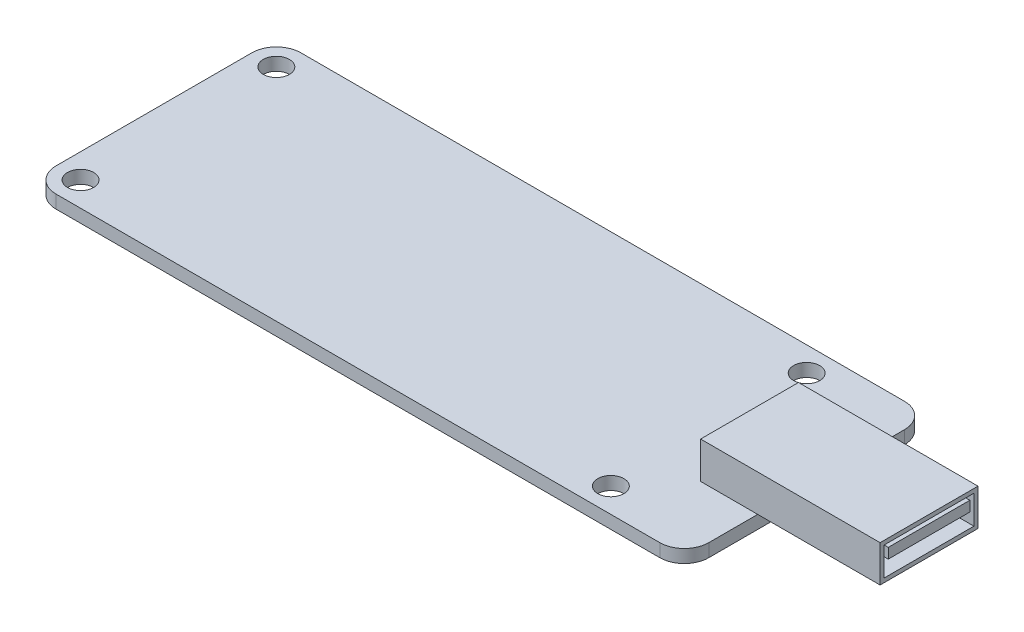
from build123d import *

# Parameters (mm, degrees)
PCB_OUTLINE_W                  = 80
PCB_OUTLINE_H                  = 30
PCB_BASE_DEPTH                 = 1.6
SKETCH3_W                      = 22
SKETCH3_H                      = 12
USB_CONNECTTOR_DUMMY_DEPTH     = 4.5
HOLE_LOCATIONS_R               = 1.6
MOUNTING_HOLES_DEPTH           = 58.18609971
SKETCH4_W                      = 11
SKETCH4_H                      = 3.5
SKETCH4_W_2                    = 10
SKETCH4_H_2                    = 1.25
USB_CONNECTOR_DUMMY_HOLE_DEPTH = 12
FILLET1_R                      = 3
SKETCH5_W                      = 1.5
SKETCH5_H                      = 1.5
CUT_EXTRUDE1_DEPTH             = 0.5


with BuildPart() as part:
    # PCB_Outline → PCB_Base (new body)
    with BuildSketch(Plane(origin=(0, 0, 0), x_dir=(1, 0, 0), z_dir=(0, 1, 0))):
        Rectangle(PCB_OUTLINE_W, PCB_OUTLINE_H)
    extrude(amount=PCB_BASE_DEPTH)

    # Sketch3 → USB_Connecttor_Dummy (add)
    with BuildSketch(Plane(origin=(0, 1.6, 0), x_dir=(1, 0, 0), z_dir=(0, 1, 0))):
        with Locations((44, 0)):
            Rectangle(SKETCH3_W, SKETCH3_H)
    extrude(amount=USB_CONNECTTOR_DUMMY_DEPTH)

    # Hole_Locations → Mounting_Holes (cut, through all)
    with BuildSketch(Plane(origin=(0, 1.6, 0), x_dir=(1, 0, 0), z_dir=(0, 1, 0))):
        with Locations(Location((-37, 12, 0), (0, 0, 270))):
            Circle(HOLE_LOCATIONS_R)
        with Locations(Location((28, 12, 0), (0, 0, 270))):
            Circle(HOLE_LOCATIONS_R)
        with Locations(Location((-37, -12, 0), (0, 0, 90))):
            Circle(HOLE_LOCATIONS_R)
        with Locations(Location((28, -12, 0), (0, 0, 90))):
            Circle(HOLE_LOCATIONS_R)
    extrude(amount=-MOUNTING_HOLES_DEPTH, mode=Mode.SUBTRACT)

    # Sketch4 → USB_Connector_Dummy_Hole (cut)
    with BuildSketch(Plane(origin=(55, 0, 0), x_dir=(0, 0, -1), z_dir=(1, 0, 0))):
        with Locations((0, 3.85)):
            Rectangle(SKETCH4_W, SKETCH4_H)
        with Locations((0, 4.475)):
            Rectangle(SKETCH4_W_2, SKETCH4_H_2, mode=Mode.SUBTRACT)
    extrude(amount=-USB_CONNECTOR_DUMMY_HOLE_DEPTH, mode=Mode.SUBTRACT)

    # Fillet1
    fillet1_edges = [part.edges().sort_by_distance(p)[0] for p in [
        (40, 0.8, 15),
        (-40, 0.8, 15),
        (-40, 0.8, -15),
        (40, 0.8, -15),
    ]]
    fillet(fillet1_edges, radius=FILLET1_R)

    # Sketch5 → Cut-Extrude1 (cut)
    with BuildSketch(Plane.XZ.offset(-1.6)):
        with Locations((50.25, -2.75)):
            Rectangle(SKETCH5_W, SKETCH5_H)
        with Locations((50.25, 2.75)):
            Rectangle(SKETCH5_W, SKETCH5_H)
    extrude(amount=-CUT_EXTRUDE1_DEPTH, mode=Mode.SUBTRACT)


solid = part.part
